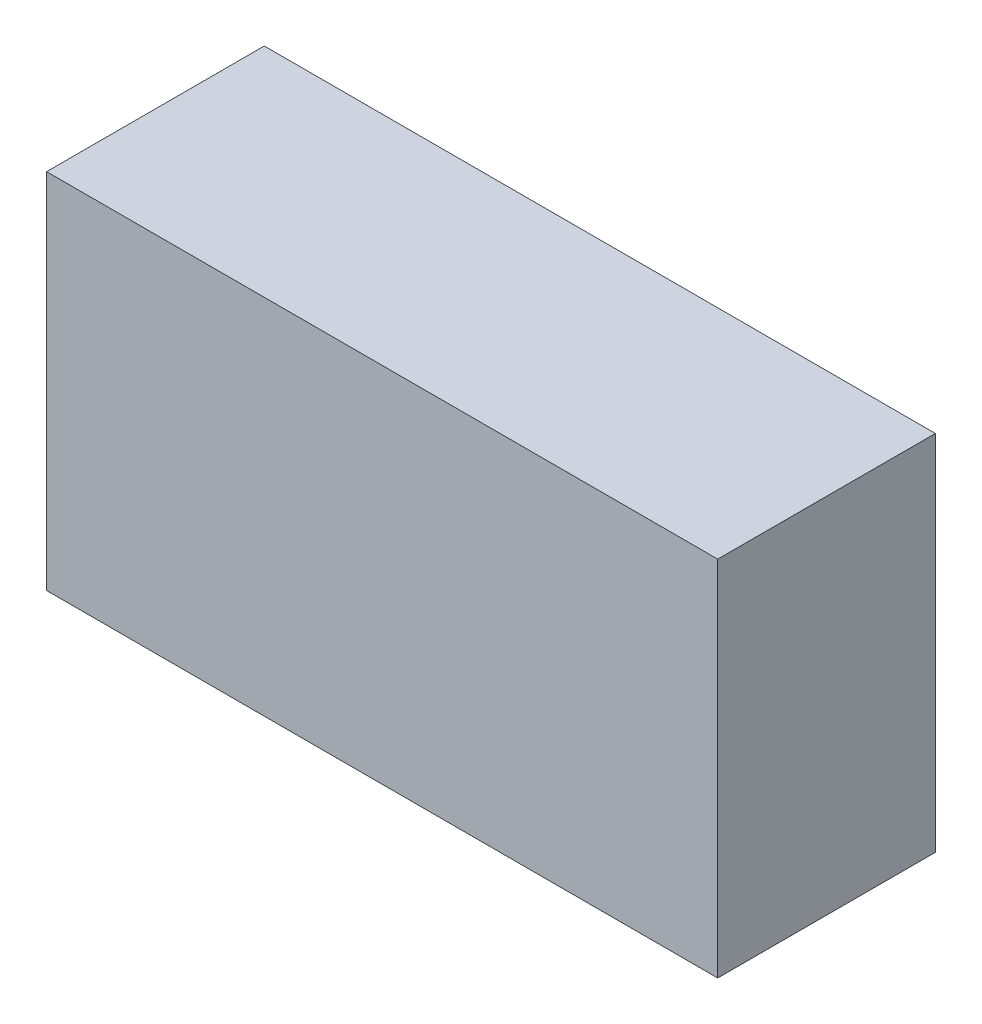
from build123d import *

# Parameters (mm, degrees)
SKETCH1_W           = 37
SKETCH1_H           = 20
BOSS_EXTRUDE1_DEPTH = 12


with BuildPart() as part:
    # Sketch1 → Boss-Extrude1 (new body)
    with BuildSketch(Plane.XY):
        with Locations((18.5, 10)):
            Rectangle(SKETCH1_W, SKETCH1_H)
    extrude(amount=BOSS_EXTRUDE1_DEPTH)


solid = part.part
